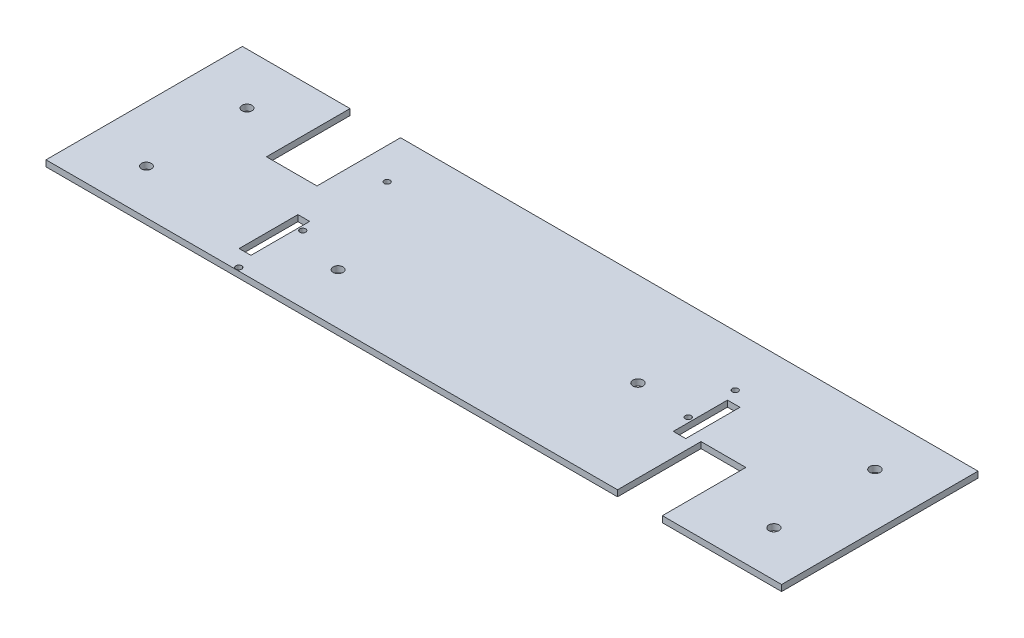
from build123d import *

# Parameters (mm, degrees)
SKETCH2_W           = 383.032
SKETCH2_H           = 101.6
BOSS_EXTRUDE1_DEPTH = 3.175
SKETCH3_R           = 2.54
SKETCH3_R_2         = 1.524
SKETCH3_W           = 26.128243683
SKETCH3_H           = 43.225676532
SKETCH3_W_2         = 6.096
SKETCH3_H_2         = 30.414908662
CUT_EXTRUDE1_DEPTH  = 5.08
SKETCH4_W           = 23.194024084
SKETCH4_H           = 43.199369669
SKETCH4_W_2         = 6.45398931
SKETCH4_H_2         = 28.034516067
SKETCH4_R           = 2.653649749
SKETCH4_R_2         = 2.61409985
SKETCH4_R_3         = 2.657297928
SKETCH4_R_4         = 1.524
CUT_EXTRUDE2_DEPTH  = 5.08
SKETCH5_W           = 11.780939099
SKETCH5_H           = 116.381398369
CUT_EXTRUDE3_DEPTH  = 6.35


with BuildPart() as part:
    # Sketch2 → Boss-Extrude1 (new body)
    with BuildSketch(Plane(origin=(0, 0, 0), x_dir=(1, 0, 0), z_dir=(0, 1, 0))):
        Rectangle(SKETCH2_W, SKETCH2_H)
    extrude(amount=BOSS_EXTRUDE1_DEPTH)

    # Sketch3 → Cut-Extrude1 (cut)
    with BuildSketch(Plane(origin=(0, 3.175, 0), x_dir=(1, 0, 0), z_dir=(0, 1, 0))):
        with Locations(Location((-160.218440268, 24.384, 0), (0, 0, 270))):
            Circle(SKETCH3_R)
        with Locations(Location((-160.218440268, -27.664005213, 0), (0, 0, 270))):
            Circle(SKETCH3_R)
        with Locations(Location((-90.932, -49.149, 0), (0, 0, 270))):
            Circle(SKETCH3_R_2)
        with Locations(Location((-90.932, -16.076263173, 0), (0, 0, 270))):
            Circle(SKETCH3_R_2)
        with Locations(Location((-90.932, 27.570881088, 0), (0, 0, 270))):
            Circle(SKETCH3_R_2)
        with Locations(Location((-64.2581016, -24.473600424, 0), (0, 0, 270))):
            Circle(SKETCH3_R)
        with Locations((-120.285878158, 29.187161734)):
            Rectangle(SKETCH3_W, SKETCH3_H)
        with Locations((-96.266, -25.392171491)):
            Rectangle(SKETCH3_W_2, SKETCH3_H_2)
    extrude(amount=-CUT_EXTRUDE1_DEPTH, mode=Mode.SUBTRACT)

    # Sketch4 → Cut-Extrude2 (cut)
    with BuildSketch(Plane(origin=(0, 3.175, 0), x_dir=(1, 0, 0), z_dir=(0, 1, 0))):
        with Locations((118.230976638, -29.200315166)):
            Rectangle(SKETCH4_W, SKETCH4_H)
        with Locations((98.119005345, 3.794694545)):
            Rectangle(SKETCH4_W_2, SKETCH4_H_2)
        with Locations(Location((164.103401606, 24.883919413, 0), (0, 0, 270))):
            Circle(SKETCH4_R)
        with Locations(Location((164.103401606, -27.372567953, 0), (0, 0, 270))):
            Circle(SKETCH4_R_2)
        with Locations(Location((64.135, 2.286, 0), (0, 0, 270))):
            Circle(SKETCH4_R_3)
        with Locations(Location((92.456, 24.257, 0), (0, 0, 270))):
            Circle(SKETCH4_R_4)
        with Locations(Location((92.456, 0, 0), (0, 0, 270))):
            Circle(SKETCH4_R_4)
    extrude(amount=-CUT_EXTRUDE2_DEPTH, mode=Mode.SUBTRACT)

    # Sketch5 → Cut-Extrude3 (cut)
    with BuildSketch(Plane(origin=(0, 3.175, 0), x_dir=(1, 0, 0), z_dir=(0, 1, 0))):
        with Locations((-194.920992361, 1.96348985)):
            Rectangle(SKETCH5_W, SKETCH5_H)
    extrude(amount=-CUT_EXTRUDE3_DEPTH, mode=Mode.SUBTRACT)


solid = part.part
